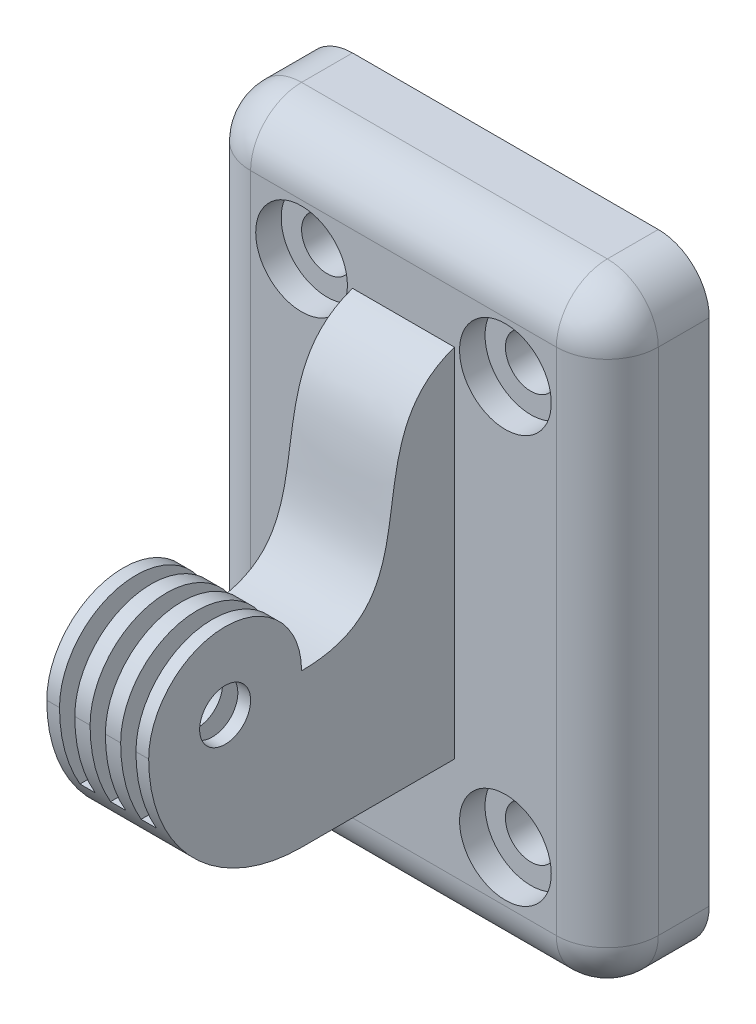
from build123d import *

# Parameters (mm, degrees)
SKETCH1_W           = 40
SKETCH1_H           = 60
BOSS_EXTRUDE1_DEPTH = 10
SKETCH2_R           = 2.5
CUT_EXTRUDE1_DEPTH  = 10
FILLET1_R           = 5
FILLET2_R           = 5
BOSS_EXTRUDE2_DEPTH = 5
CUT_EXTRUDE2_DEPTH  = 0.75
LPATTERN1_COUNT     = 2
LPATTERN1_PITCH     = 3
LPATTERN2_COUNT     = 2
LPATTERN2_PITCH     = 3
SKETCH5_R           = 4.5
CUT_EXTRUDE3_DEPTH  = 2.5
SKETCH6_R           = 2.5
CUT_EXTRUDE4_DEPTH  = 23.5


with BuildPart() as part:
    # Sketch1 → Boss-Extrude1 (new body)
    with BuildSketch(Plane.XY):
        Rectangle(SKETCH1_W, SKETCH1_H)
    extrude(amount=BOSS_EXTRUDE1_DEPTH)

    # Sketch2 → Cut-Extrude1 (cut)
    with BuildSketch(Plane.XY.offset(10)):
        with Locations((-10, -20)):
            Circle(SKETCH2_R)
        with Locations(Location((10, -20, 0), (0, 0, 180))):
            Circle(SKETCH2_R)
        with Locations((10, 20)):
            Circle(SKETCH2_R)
        with Locations(Location((-10, 20, 0), (0, 0, 180))):
            Circle(SKETCH2_R)
    extrude(amount=-CUT_EXTRUDE1_DEPTH, mode=Mode.SUBTRACT)

    # Fillet1
    fillet1_edges = [part.edges().sort_by_distance(p)[0] for p in [
        (20, -30, 5),
        (-20, -30, 5),
        (-20, 30, 5),
        (20, 30, 5),
    ]]
    fillet(fillet1_edges, radius=FILLET1_R)

    # Fillet2
    fillet2_edges = [part.edges().sort_by_distance(p)[0] for p in [
        (0, 30, 10),
        (20, 0, 10),
        (-20, 0, 10),
        (0, -30, 10),
        (-18.535533906, 28.535533906, 10),
        (-18.535533906, -28.535533906, 10),
        (18.535533906, -28.535533906, 10),
        (18.535533906, 28.535533906, 10),
    ]]
    fillet(fillet2_edges, radius=FILLET2_R)

    # Sketch3 → Boss-Extrude2 (add, symmetric)
    with BuildSketch(Plane(origin=(0, 0, 0), x_dir=(0, 0, -1), z_dir=(1, 0, 0))):
        with BuildLine():
            Line((-10, -15), (-25, -15))
            ThreePointArc((-25, -15), (-35.606601718, -10.606601718), (-40, 0))
            ThreePointArc((-40, 0), (-32.5, 7.5), (-25, 0))
            add(Edge.make_bspline(
                [(-25, 0), (-11.206458261, 0.023360815), (-20.592449016, 16.330430805), (-10, 20)],
                knots=[0, 0, 0, 0, 1, 1, 1, 1], degree=3))
            Line((-10, 20), (-10, -15))
        make_face()
    extrude(amount=BOSS_EXTRUDE2_DEPTH, both=True)

    # Sketch4 → Cut-Extrude2 (cut, symmetric)
    with BuildSketch(Plane(origin=(0, 0, 0), x_dir=(0, 0, -1), z_dir=(1, 0, 0))):
        with BuildLine():
            Line((-32.5, -7.5), (-40, -7.5))
            Line((-40, -7.5), (-40, 0))
            ThreePointArc((-40, 0), (-27.196699141, 5.303300859), (-32.5, -7.5))
        make_face()
    cut_extrude2 = extrude(amount=CUT_EXTRUDE2_DEPTH, both=True, mode=Mode.SUBTRACT)

    # LPattern1: Cut-Extrude2 ×2
    with Locations(*[(-i * LPATTERN1_PITCH, 0, 0) for i in range(1, LPATTERN1_COUNT)]):
        add(cut_extrude2, mode=Mode.SUBTRACT)

    # LPattern2: Cut-Extrude2 ×2
    with Locations(*[(i * LPATTERN2_PITCH, 0, 0) for i in range(1, LPATTERN2_COUNT)]):
        add(cut_extrude2, mode=Mode.SUBTRACT)

    # Sketch5 → Cut-Extrude3 (cut, symmetric)
    with BuildSketch(Plane.XY.offset(10)):
        with Locations(Location((-10, -20, 0), (0, 0, 180))):
            Circle(SKETCH5_R)
        with Locations((-10, 20)):
            Circle(SKETCH5_R)
        with Locations((10, -20)):
            Circle(SKETCH5_R)
        with Locations(Location((10, 20, 0), (0, 0, 180))):
            Circle(SKETCH5_R)
    extrude(amount=CUT_EXTRUDE3_DEPTH, both=True, mode=Mode.SUBTRACT)

    # Sketch6 → Cut-Extrude4 (cut, symmetric)
    with BuildSketch(Plane(origin=(5, 0, 0), x_dir=(0, 0, -1), z_dir=(1, 0, 0))):
        with Locations((-32.5, 0)):
            Circle(SKETCH6_R)
    extrude(amount=CUT_EXTRUDE4_DEPTH, both=True, mode=Mode.SUBTRACT)


solid = part.part
